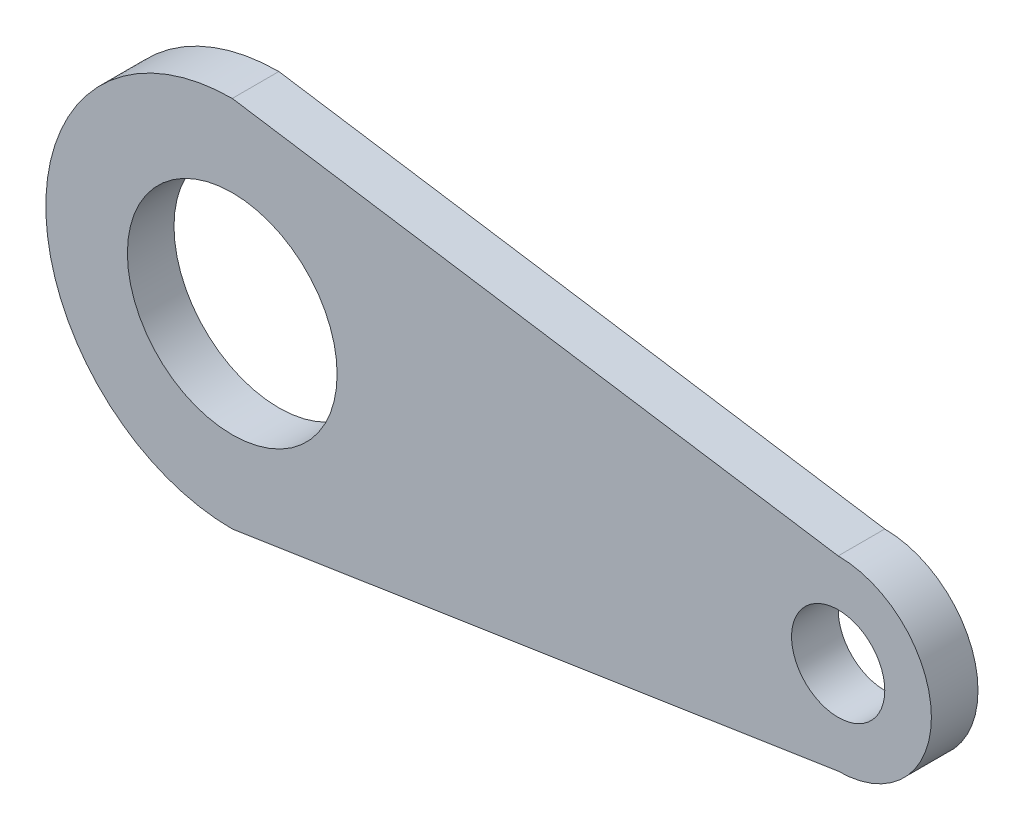
from build123d import *

# Parameters (mm, degrees)
SKETCH3_R           = 22.5
SKETCH3_R_2         = 10
BOSS_EXTRUDE1_DEPTH = 10


with BuildPart() as part:
    # Sketch3 → Boss-Extrude1 (new body)
    with BuildSketch(Plane.XY):
        with BuildLine():
            Line((-107.748780519, 40), (22.251219481, 20))
            ThreePointArc((22.251219481, 20), (42.251219481, 0), (22.251219481, -20))
            Line((22.251219481, -20), (-107.748780519, -40))
            ThreePointArc((-107.748780519, -40), (-147.748780519, 0), (-107.748780519, 40))
        make_face()
        with Locations((-107.748780519, 0)):
            Circle(SKETCH3_R, mode=Mode.SUBTRACT)
        with Locations((22.251219481, 0)):
            Circle(SKETCH3_R_2, mode=Mode.SUBTRACT)
    extrude(amount=BOSS_EXTRUDE1_DEPTH)


solid = part.part
